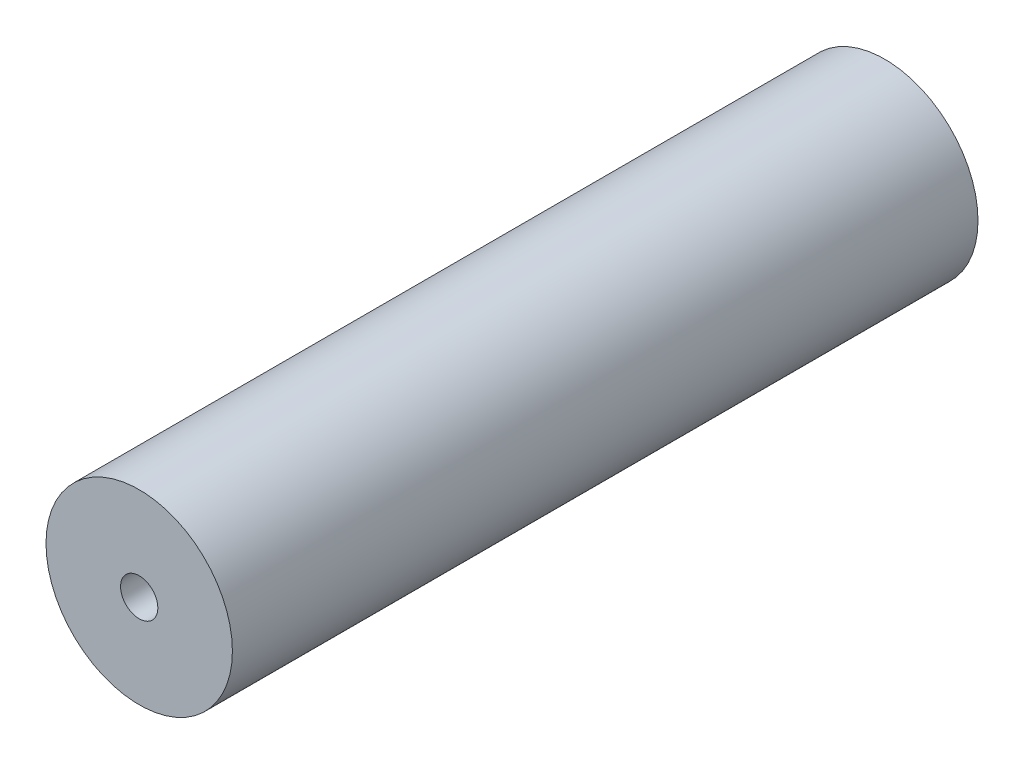
from build123d import *

# Parameters (mm, degrees)
IZIM1_R                     = 10
Y_KSEKLIK_EKSTR_ZYON1_DEPTH = 80
IZIM2_R                     = 2
KES_EKSTR_ZYON1_DEPTH       = 80


with BuildPart() as part:
    # Çizim1 → Yükseklik-Ekstrüzyon1 (new body)
    with BuildSketch(Plane.XY):
        Circle(IZIM1_R)
    extrude(amount=Y_KSEKLIK_EKSTR_ZYON1_DEPTH)

    # Çizim2 → Kes-Ekstrüzyon1 (cut)
    with BuildSketch(Plane.XY.offset(80)):
        Circle(IZIM2_R)
    extrude(amount=-KES_EKSTR_ZYON1_DEPTH, mode=Mode.SUBTRACT)


solid = part.part
